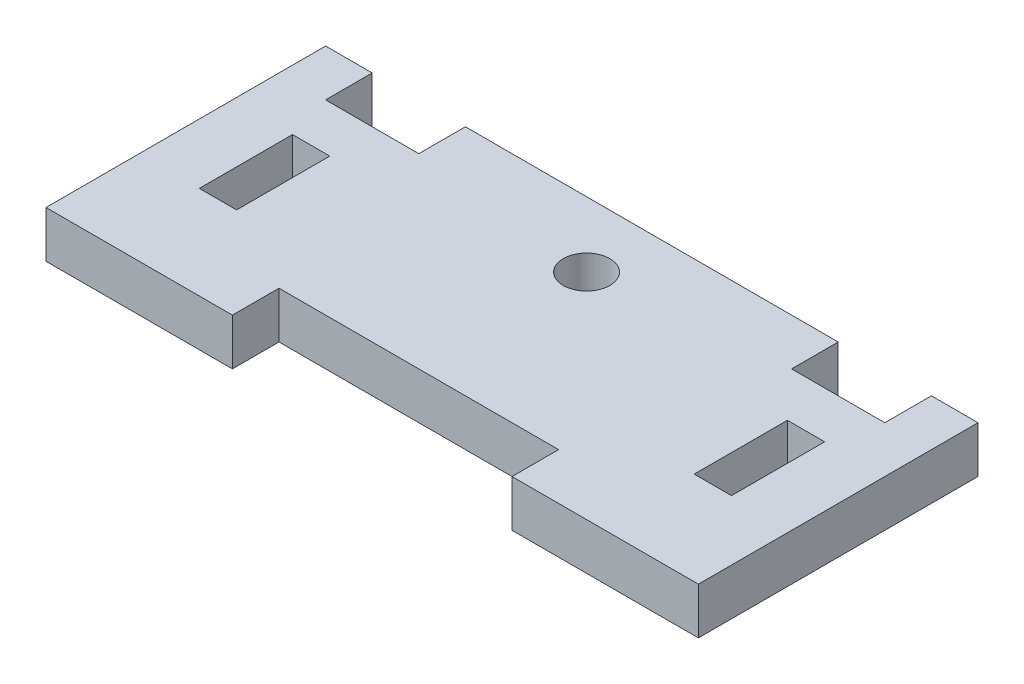
from build123d import *

# Parameters (mm, degrees)
SKETCH_1_R      = 2.5
SKETCH_1_W      = 4
SKETCH_1_H      = 10
EXTRUDE_1_DEPTH = 5


with BuildPart() as part:
    # 草图1 → 凸台-拉伸1 (new body)
    with BuildSketch(Plane(origin=(0, 0, 0), x_dir=(1, 0, 0), z_dir=(0, 1, 0))):
        Polygon((0, 0), (20, 0), (20, 5), (50, 5), (50, 0), (70, 0), (70, 30), (65, 30), (65, 25), (55, 25), (55, 30), (15, 30), (15, 25), (5, 25), (5, 30), (0, 30), align=None)
        with Locations(Location((35, 23, 0), (0, 0, 270))):
            Circle(SKETCH_1_R, mode=Mode.SUBTRACT)
        with Locations((61.55, 15)):
            Rectangle(SKETCH_1_W, SKETCH_1_H, mode=Mode.SUBTRACT)
        with Locations((8.45, 15)):
            Rectangle(SKETCH_1_W, SKETCH_1_H, mode=Mode.SUBTRACT)
    extrude(amount=EXTRUDE_1_DEPTH)


solid = part.part
